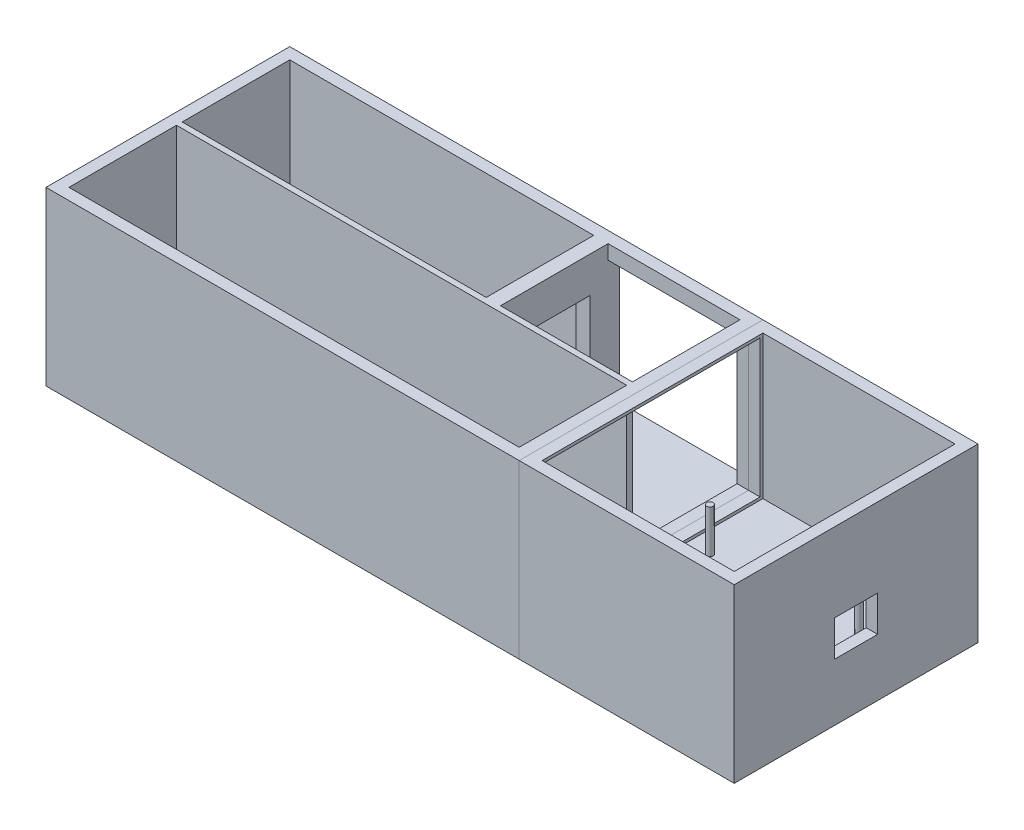
from build123d import *

# Parameters (mm, degrees)
IZIM1_W                     = 75
IZIM1_H                     = 85
Y_KSEKLIK_EKSTR_ZYON1_DEPTH = 60
IZIM3_W                     = 67
IZIM3_H                     = 77
KES_EKSTR_ZYON1_DEPTH       = 50
IZIM4_W                     = 85
IZIM4_H                     = 60
Y_KSEKLIK_EKSTR_ZYON2_DEPTH = 165
IZIM5_W                     = 157
IZIM5_H                     = 77
KES_EKSTR_ZYON2_DEPTH       = 50
IZIM7_W                     = 15
IZIM7_H                     = 12.5
KES_EKSTR_ZYON4_DEPTH       = 4
IZIM8_W                     = 75
IZIM8_H                     = 48
KES_EKSTR_ZYON5_DEPTH       = 10
IZIM9_W                     = 2
IZIM9_H                     = 50
Y_KSEKLIK_EKSTR_ZYON3_DEPTH = 157
IZIM11_R                    = 1.13
KES_EKSTR_ZYON6_DEPTH       = 1
Y_KSEKLIK_EKSTR_ZYON4_START = 16
IZIM12_R                    = 1.13
Y_KSEKLIK_EKSTR_ZYON4_DEPTH = 16
IZIM13_W                    = 45
IZIM13_H                    = 45
KES_EKSTR_ZYON7_DEPTH       = 4
Y_KSEKLIK_EKSTR_ZYON5_REACH = 195.355
IZIM14_W                    = 5
IZIM14_H                    = 50
IZIM15_W                    = 25
IZIM15_H                    = 25
KES_EKSTR_ZYON8_DEPTH       = 5


with BuildPart() as part:
    # Çizim1 → Yükseklik-Ekstrüzyon1 (new body)
    with BuildSketch(Plane(origin=(0, 0, 0), x_dir=(1, 0, 0), z_dir=(0, 1, 0))):
        with Locations((37.5, 42.5)):
            Rectangle(IZIM1_W, IZIM1_H)
    extrude(amount=Y_KSEKLIK_EKSTR_ZYON1_DEPTH)

    # Çizim3 → Kes-Ekstrüzyon1 (cut)
    with BuildSketch(Plane(origin=(0, 60, 0), x_dir=(1, 0, 0), z_dir=(0, 1, 0))):
        with Locations((37.5, 42.5)):
            Rectangle(IZIM3_W, IZIM3_H)
    extrude(amount=-KES_EKSTR_ZYON1_DEPTH, mode=Mode.SUBTRACT)

    # Çizim7 → Kes-Ekstrüzyon4 (cut)
    with BuildSketch(Plane(origin=(75, 0, 0), x_dir=(0, 0, -1), z_dir=(1, 0, 0))):
        with Locations((42.5, 26.25)):
            Rectangle(IZIM7_W, IZIM7_H)
    extrude(amount=-KES_EKSTR_ZYON4_DEPTH, mode=Mode.SUBTRACT)


with BuildPart() as body_2:
    # Çizim4 → Yükseklik-Ekstrüzyon2 (new body)
    with BuildSketch(Plane.ZY):
        with Locations((-42.5, 30)):
            Rectangle(IZIM4_W, IZIM4_H)
    extrude(amount=Y_KSEKLIK_EKSTR_ZYON2_DEPTH)

    # Çizim5 → Kes-Ekstrüzyon2 (cut)
    with BuildSketch(Plane(origin=(0, 60, 0), x_dir=(1, 0, 0), z_dir=(0, 1, 0))):
        with Locations((-82.5, 42.5)):
            Rectangle(IZIM5_W, IZIM5_H)
    extrude(amount=-KES_EKSTR_ZYON2_DEPTH, mode=Mode.SUBTRACT)


with BuildPart() as kes_ekstr_zyon5_tool:
    # Çizim8 → Kes-Ekstrüzyon5 (new body)
    with BuildSketch(Plane(origin=(4, 0, 0), x_dir=(0, 0, -1), z_dir=(1, 0, 0))):
        with Locations((42.5, 35)):
            Rectangle(IZIM8_W, IZIM8_H)
    extrude(amount=-KES_EKSTR_ZYON5_DEPTH)


with BuildPart() as part_1:
    add(part.part)

    # Kes-Ekstrüzyon5: cut by kes_ekstr_zyon5_tool
    add(kes_ekstr_zyon5_tool.part, mode=Mode.SUBTRACT)

    # Çizim11 → Kes-Ekstrüzyon6 (cut)
    with BuildSketch(Plane(origin=(0, 10, 0), x_dir=(1, 0, 0), z_dir=(0, 1, 0))):
        with Locations(Location((11.5, 55, 0), (0, 0, 270))):
            Circle(IZIM11_R)
        with Locations(Location((63.5, 55, 0), (0, 0, 270))):
            Circle(IZIM11_R)
        with Locations(Location((63.5, 30, 0), (0, 0, 270))):
            Circle(IZIM11_R)
        with Locations(Location((11.5, 30, 0), (0, 0, 270))):
            Circle(IZIM11_R)
    extrude(amount=-KES_EKSTR_ZYON6_DEPTH, mode=Mode.SUBTRACT)

    # Çizim12 → Yükseklik-Ekstrüzyon4 (add)
    with BuildSketch(Plane(origin=(0, 9, 0), x_dir=(1, 0, 0), z_dir=(0, 1, 0)).offset(Y_KSEKLIK_EKSTR_ZYON4_START)):
        with Locations(Location((11.5, 55, 0), (0, 0, 270))):
            Circle(IZIM12_R)
        with Locations(Location((63.5, 55, 0), (0, 0, 270))):
            Circle(IZIM12_R)
        with Locations(Location((63.5, 30, 0), (0, 0, 270))):
            Circle(IZIM12_R)
        with Locations(Location((11.5, 30, 0), (0, 0, 270))):
            Circle(IZIM12_R)
    extrude(amount=-Y_KSEKLIK_EKSTR_ZYON4_DEPTH)


with BuildPart() as body_2_1:
    add(body_2.part)

    # Kes-Ekstrüzyon5: cut by kes_ekstr_zyon5_tool
    add(kes_ekstr_zyon5_tool.part, mode=Mode.SUBTRACT)

    # Çizim9 → Yükseklik-Ekstrüzyon3 (add)
    with BuildSketch(Plane(origin=(-161, 0, 0), x_dir=(0, 0, -1), z_dir=(1, 0, 0))):
        with Locations((42.5, 35)):
            Rectangle(IZIM9_W, IZIM9_H)
    extrude(amount=Y_KSEKLIK_EKSTR_ZYON3_DEPTH)

    # Çizim13 → Kes-Ekstrüzyon7 (cut)
    with BuildSketch(Plane(origin=(0, 0, -85), x_dir=(-1, 0, 0), z_dir=(0, 0, -1))):
        with Locations((27.5, 32.5)):
            Rectangle(IZIM13_W, IZIM13_H)
    extrude(amount=-KES_EKSTR_ZYON7_DEPTH, mode=Mode.SUBTRACT)

    # Çizim14 → Yükseklik-Ekstrüzyon5 (add, up to next)
    with BuildSketch(Plane.XY.offset(-81), mode=Mode.PRIVATE) as y_kseklik_ekstr_zyon5_sk1:
        with Locations((-52.5, 35)):
            Rectangle(IZIM14_W, IZIM14_H)
    y_kseklik_ekstr_zyon5_tool1 = extrude(y_kseklik_ekstr_zyon5_sk1.sketch, amount=Y_KSEKLIK_EKSTR_ZYON5_REACH, mode=Mode.PRIVATE) - body_2_1.part
    add(y_kseklik_ekstr_zyon5_tool1.solids().sort_by_distance((-52.5, 35, -81))[0])

    # Çizim15 → Kes-Ekstrüzyon8 (cut)
    with BuildSketch(Plane(origin=(-50, 0, 0), x_dir=(0, 0, -1), z_dir=(1, 0, 0))):
        with Locations((62.25, 35)):
            Rectangle(IZIM15_W, IZIM15_H)
    extrude(amount=-KES_EKSTR_ZYON8_DEPTH, mode=Mode.SUBTRACT)


solid = Compound([part_1.part, body_2_1.part])
